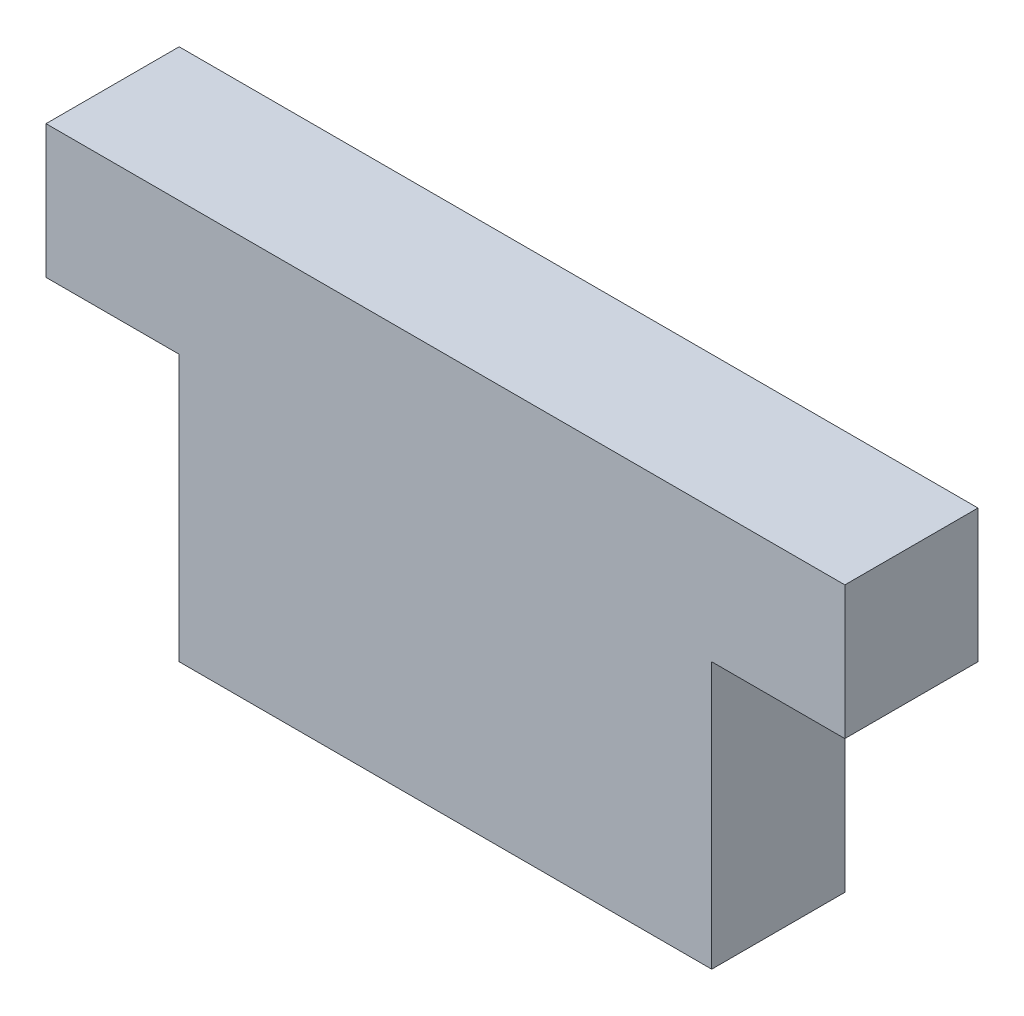
from build123d import *

# Parameters (mm, degrees)
SKETCH1_W           = 20
SKETCH1_H           = 10
BOSS_EXTRUDE1_DEPTH = 5


with BuildPart() as part:
    # Sketch1 → Boss-Extrude1 (new body)
    with BuildSketch(Plane.XY):
        with Locations((-10, -5)):
            Rectangle(SKETCH1_W, SKETCH1_H)
        Polygon((-20, 0), (0, 0), (5, 0), (5, 5), (-25, 5), (-25, 0), align=None)
    extrude(amount=BOSS_EXTRUDE1_DEPTH)


solid = part.part
